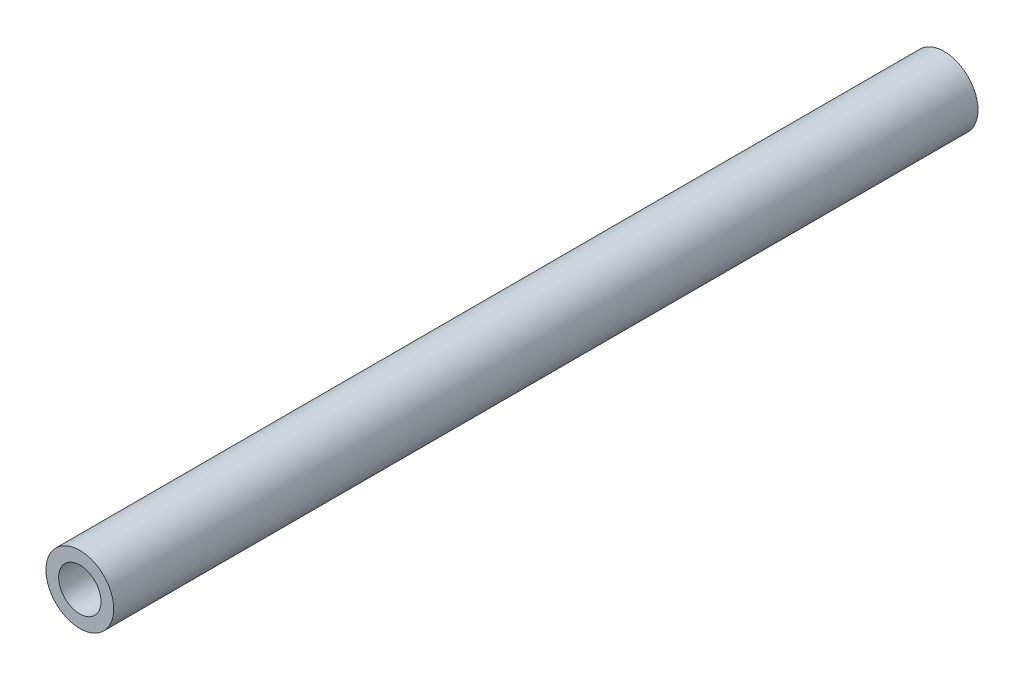
from build123d import *

# Parameters (mm, degrees)
SZKIC1_R                    = 8
SZKIC1_R_2                  = 4
DODANIE_WYCI_GNI_CIE1_DEPTH = 102
SZKIC2_R                    = 5
WYTNIJ_WYCI_GNI_CIE1_DEPTH  = 40
WYTNIJ_WYCI_GNI_CIE2_START  = -30
SZKIC3_R                    = 5
WYTNIJ_WYCI_GNI_CIE2_DEPTH  = 30


with BuildPart() as part:
    # Szkic1 → Dodanie-wyciągnięcie1 (new, symmetric)
    with BuildSketch(Plane.XY):
        Circle(SZKIC1_R)
        Circle(SZKIC1_R_2, mode=Mode.SUBTRACT)
    extrude(amount=DODANIE_WYCI_GNI_CIE1_DEPTH, both=True)

    # Szkic2 → Wytnij-wyciągnięcie1 (cut)
    with BuildSketch(Plane.XY.offset(102)):
        Circle(SZKIC2_R)
    extrude(amount=-WYTNIJ_WYCI_GNI_CIE1_DEPTH, mode=Mode.SUBTRACT)

    # Szkic3 → Wytnij-wyciągnięcie2 (cut)
    with BuildSketch(Plane(origin=(0, 0, -102), x_dir=(-1, 0, 0), z_dir=(0, 0, -1)).offset(WYTNIJ_WYCI_GNI_CIE2_START)):
        with Locations(Location((0, 0, 0), (0, 0, 180))):
            Circle(SZKIC3_R)
    extrude(amount=WYTNIJ_WYCI_GNI_CIE2_DEPTH, mode=Mode.SUBTRACT)


solid = part.part
